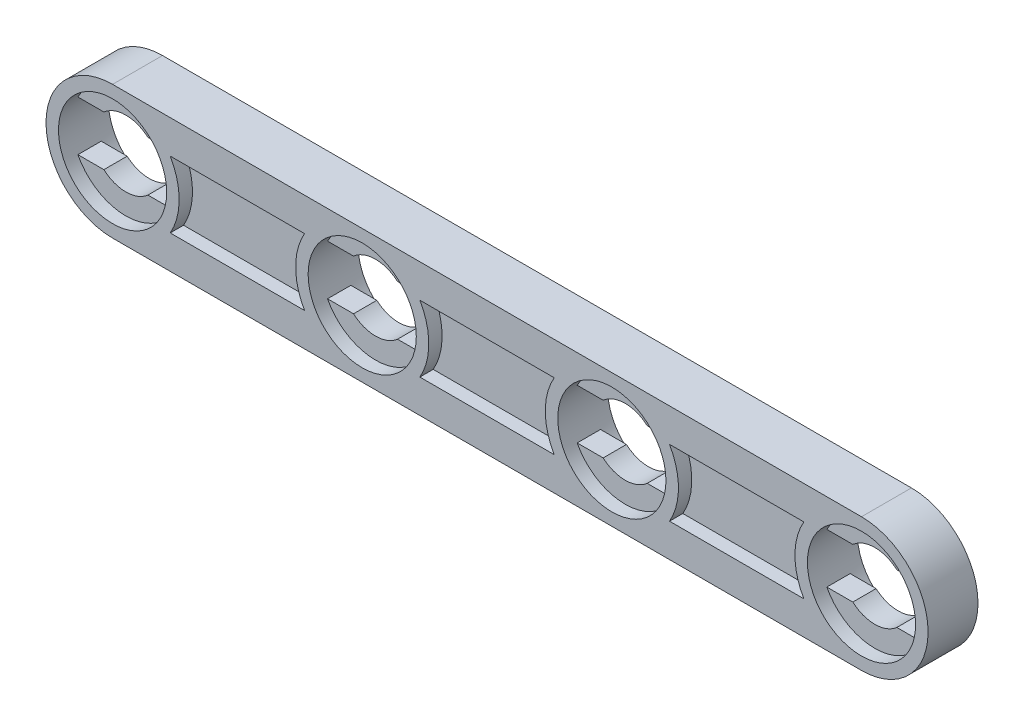
from build123d import *

# Parameters (mm, degrees)
EXTRUDE_1_DEPTH          = 3
CUT_EXTRUDE_1_REACH      = 51.254
SKETCH_3_R               = 3.25
CUT_EXTRUDE_2_DEPTH      = 0.8
CUT_EXTRUDE_START        = -2.2
SKETCH_3_2_R             = 3.25
CUT_EXTRUDE_3_DEPTH      = 0.8
CUT_EXTRUDE_4_DEPTH      = 0.8
SKETCH_5_W               = 7
SKETCH_5_H               = 4
CUT_EXTRUDE_6_DEPTH      = 0.8
MIRROR_2_COPY_1_REACH    = 51.254
MIRROR_2_COPY_2_SKETCH_R = 3.25
MIRROR_2_COPY_2_DEPTH    = 0.8
MIRROR_START             = -2.2
MIRROR_2_COPY_3_SKETCH_R = 3.25
MIRROR_2_COPY_3_DEPTH    = 0.8


with BuildPart() as part:
    # 草图1 → 凸台-拉伸1 (new body)
    with BuildSketch(Plane.XY):
        with BuildLine():
            Line((0, 4), (45, 4))
            ThreePointArc((45, 4), (49, 0), (45, -4))
            Line((45, -4), (0, -4))
            ThreePointArc((0, -4), (-4, 0), (0, 4))
        make_face()
    extrude(amount=-EXTRUDE_1_DEPTH)

    # 草图2 → 切除-拉伸1 (cut, up to next)
    with BuildSketch(Plane.XY, mode=Mode.PRIVATE) as cut_extrude_1_sk1:
        with BuildLine():
            Line((1.322875656, -1.5), (2.883140649, -1.5))
            ThreePointArc((2.883140649, -1.5), (3.25, 0), (2.883140649, 1.5))
            Line((2.883140649, 1.5), (1.322875656, 1.5))
            ThreePointArc((1.322875656, 1.5), (0, 2), (-1.322875656, 1.5))
            Line((-1.322875656, 1.5), (-2.883140649, 1.5))
            ThreePointArc((-2.883140649, 1.5), (-3.25, 0), (-2.883140649, -1.5))
            Line((-2.883140649, -1.5), (-1.322875656, -1.5))
            ThreePointArc((-1.322875656, -1.5), (0, -2), (1.322875656, -1.5))
        make_face()
    cut_extrude_1_tool1 = extrude(cut_extrude_1_sk1.sketch, amount=-CUT_EXTRUDE_1_REACH, mode=Mode.PRIVATE) & part.part
    cut_extrude_1 = cut_extrude_1_tool1.solids().sort_by_distance((0, 0, 0))[0]
    add(cut_extrude_1, mode=Mode.SUBTRACT)

    # 草图3 → 切除-拉伸2 (cut)
    with BuildSketch(Plane.XY):
        Circle(SKETCH_3_R)
    cut_extrude_2 = extrude(amount=-CUT_EXTRUDE_2_DEPTH, mode=Mode.SUBTRACT)

    # 草图3<2> → 切除-拉伸3 (cut)
    with BuildSketch(Plane.XY.offset(CUT_EXTRUDE_START)):
        Circle(SKETCH_3_2_R)
    cut_extrude_3 = extrude(amount=-CUT_EXTRUDE_3_DEPTH, mode=Mode.SUBTRACT)

    # 草图4 → 切除-拉伸4 (cut)
    with BuildSketch(Plane.XY):
        with BuildLine():
            Line((3.464101615, 2), (11.535898385, 2))
            ThreePointArc((11.535898385, 2), (11, 0), (11.535898385, -2))
            Line((11.535898385, -2), (3.464101615, -2))
            ThreePointArc((3.464101615, -2), (4, 0), (3.464101615, 2))
        make_face()
    cut_extrude_4 = extrude(amount=-CUT_EXTRUDE_4_DEPTH, mode=Mode.SUBTRACT)

    # 草图5 → 切除-拉伸6 (cut)
    with BuildSketch(Plane(origin=(0, 0, -3), x_dir=(-1, 0, 0), z_dir=(0, 0, -1))):
        with Locations((-7.5, 0)):
            Rectangle(SKETCH_5_W, SKETCH_5_H)
    cut_extrude_6 = extrude(amount=-CUT_EXTRUDE_6_DEPTH, mode=Mode.SUBTRACT)

    # 镜向1: 切除-拉伸1, 切除-拉伸2, 切除-拉伸3 across plane
    add(cut_extrude_1.mirror(Plane(origin=(7.5, 0, 0), x_dir=(0, 0, 1), z_dir=(1, 0, 0))), mode=Mode.SUBTRACT)
    add(cut_extrude_2.mirror(Plane(origin=(7.5, 0, 0), x_dir=(0, 0, 1), z_dir=(1, 0, 0))), mode=Mode.SUBTRACT)
    add(cut_extrude_3.mirror(Plane(origin=(7.5, 0, 0), x_dir=(0, 0, 1), z_dir=(1, 0, 0))), mode=Mode.SUBTRACT)

    # 镜向2: 切除-拉伸1, 切除-拉伸2, 切除-拉伸3 across plane
    add(cut_extrude_1.mirror(Plane(origin=(22.5, 0, 0), x_dir=(0, 0, 1), z_dir=(1, 0, 0))), mode=Mode.SUBTRACT)
    add(cut_extrude_2.mirror(Plane(origin=(22.5, 0, 0), x_dir=(0, 0, 1), z_dir=(1, 0, 0))), mode=Mode.SUBTRACT)
    add(cut_extrude_3.mirror(Plane(origin=(22.5, 0, 0), x_dir=(0, 0, 1), z_dir=(1, 0, 0))), mode=Mode.SUBTRACT)

    # 镜向2 copy 1 sketch → 镜向2 copy 1 (cut, up to next)
    with BuildSketch(Plane(origin=(30, 0, 0), x_dir=(1, 0, 0), z_dir=(0, 0, 1)), mode=Mode.PRIVATE) as mirror_2_copy_1_sk1:
        with BuildLine():
            Line((1.322875656, -1.5), (2.883140649, -1.5))
            ThreePointArc((2.883140649, -1.5), (3.25, 0), (2.883140649, 1.5))
            Line((2.883140649, 1.5), (1.322875656, 1.5))
            ThreePointArc((1.322875656, 1.5), (0, 2), (-1.322875656, 1.5))
            Line((-1.322875656, 1.5), (-2.883140649, 1.5))
            ThreePointArc((-2.883140649, 1.5), (-3.25, 0), (-2.883140649, -1.5))
            Line((-2.883140649, -1.5), (-1.322875656, -1.5))
            ThreePointArc((-1.322875656, -1.5), (0, -2), (1.322875656, -1.5))
        make_face()
    mirror_2_copy_1_tool1 = extrude(mirror_2_copy_1_sk1.sketch, amount=-MIRROR_2_COPY_1_REACH, mode=Mode.PRIVATE) & part.part
    add(mirror_2_copy_1_tool1.solids().sort_by_distance((30, 0, 0))[0], mode=Mode.SUBTRACT)

    # 镜向2 copy 2 sketch → 镜向2 copy 2 (cut)
    with BuildSketch(Plane(origin=(30, 0, 0), x_dir=(1, 0, 0), z_dir=(0, 0, 1))):
        Circle(MIRROR_2_COPY_2_SKETCH_R)
    extrude(amount=-MIRROR_2_COPY_2_DEPTH, mode=Mode.SUBTRACT)

    # 镜向2 copy 3 sketch → 镜向2 copy 3 (cut)
    with BuildSketch(Plane(origin=(30, 0, 0), x_dir=(1, 0, 0), z_dir=(0, 0, 1)).offset(MIRROR_START)):
        Circle(MIRROR_2_COPY_3_SKETCH_R)
    extrude(amount=-MIRROR_2_COPY_3_DEPTH, mode=Mode.SUBTRACT)

    # 镜向3: 切除-拉伸4, 切除-拉伸6 across plane
    add(cut_extrude_4.mirror(Plane(origin=(15, 0, 0), x_dir=(0, 0, 1), z_dir=(1, 0, 0))), mode=Mode.SUBTRACT)
    add(cut_extrude_6.mirror(Plane(origin=(15, 0, 0), x_dir=(0, 0, 1), z_dir=(1, 0, 0))), mode=Mode.SUBTRACT)

    # 镜向4: 切除-拉伸4, 切除-拉伸6 across plane
    add(cut_extrude_4.mirror(Plane(origin=(22.5, 0, 0), x_dir=(0, 0, 1), z_dir=(1, 0, 0))), mode=Mode.SUBTRACT)
    add(cut_extrude_6.mirror(Plane(origin=(22.5, 0, 0), x_dir=(0, 0, 1), z_dir=(1, 0, 0))), mode=Mode.SUBTRACT)


solid = part.part
